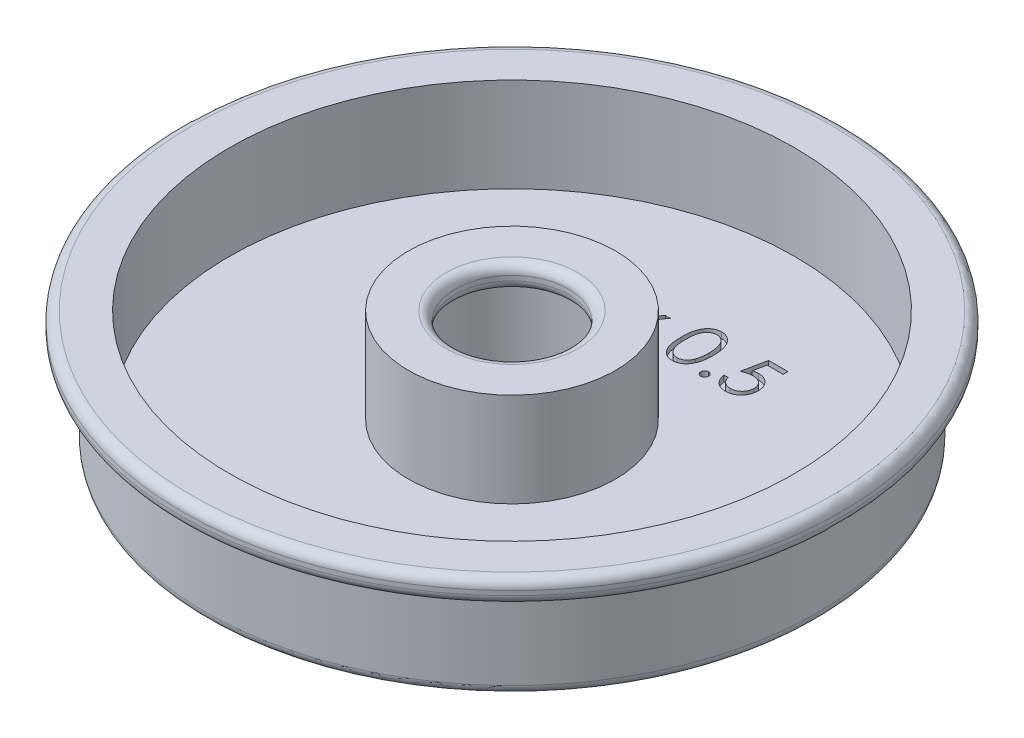
from build123d import *

# Parameters (mm, degrees)
CUT_EXTRUDE1_DEPTH = 0.79375


with BuildPart() as part:
    # Sketch1 → Revolve2 (revolve)
    with BuildSketch(Plane.XY, mode=Mode.PRIVATE) as revolve2_sk:
        with BuildLine():
            ThreePointArc((7.62, 14.641825196), (7.991974388, 15.539850808), (8.89, 15.911825196))
            Line((8.89, 15.911825196), (13.97, 15.911825196))
            Line((13.97, 15.911825196), (13.97, 3.211825196))
            Line((13.97, 3.211825196), (38.1, 3.211825196))
            Line((38.1, 3.211825196), (38.1, 15.911825196))
            Line((38.1, 15.911825196), (43.18, 15.911825196))
            ThreePointArc((43.18, 15.911825196), (44.078025612, 15.539850808), (44.45, 14.641825196))
            Line((44.45, 14.641825196), (44.45, 14.043650391))
            ThreePointArc((44.45, 14.043650391), (44.078025612, 13.145624779), (43.18, 12.773650391))
            Line((43.18, 12.773650391), (42.545, 12.773650391))
            ThreePointArc((42.545, 12.773650391), (41.646974388, 12.401676004), (41.275, 11.503650391))
            Line((41.275, 11.503650391), (41.275, 1.306825196))
            ThreePointArc((41.275, 1.306825196), (40.903025612, 0.408799584), (40.005, 0.036825196))
            Line((40.005, 0.036825196), (12.065, 0.036825196))
            ThreePointArc((12.065, 0.036825196), (11.166974388, 0.408799584), (10.795, 1.306825196))
            Line((10.795, 1.306825196), (10.795, 11.466825196))
            ThreePointArc((10.795, 11.466825196), (10.423025612, 12.364850808), (9.525, 12.736825196))
            Line((9.525, 12.736825196), (8.89, 12.736825196))
            ThreePointArc((8.89, 12.736825196), (7.991974388, 13.108799584), (7.62, 14.006825196))
            Line((7.62, 14.006825196), (7.62, 14.641825196))
        make_face()
    revolve(revolve2_sk.sketch.rotate(Axis((0, 0, 0), (0, 1, 0)), 90), axis=Axis((0, 0, 0), (0, 1, 0)))

    # Sketch2 → Cut-Extrude1 (cut)
    # profile 1 of 5: a face of its own
    with BuildSketch(Plane(origin=(0, 3.211825196, 0), x_dir=(1, 0, 0), z_dir=(0, 1, 0))):
        with BuildLine():
            Line((-11.395057384, 22.729399173), (-11.964929179, 22.729399173))
            add(Edge.make_bspline(
                [(-11.964929179, 22.729399173), (-11.949490423, 22.793320966), (-11.919308917, 22.918282841), (-11.856357605, 23.096821729), (-11.787778957, 23.265774403), (-11.705430153, 23.42197728), (-11.615607127, 23.568569575), (-11.512695904, 23.702226415), (-11.401444407, 23.826347081), (-11.278390571, 23.936498241), (-11.149342856, 24.036243549), (-11.012482903, 24.121288296), (-10.870564224, 24.194447831), (-10.72260354, 24.254718823), (-10.568160343, 24.300122273), (-10.408630884, 24.333063906), (-10.243597105, 24.354456356), (-10.131569333, 24.356544169), (-10.074684788, 24.357604302)],
                knots=[0, 0, 0, 0, 1.162005537, 2.271625781, 3.343758855, 4.383309926, 5.390229558, 6.379919256, 7.361854164, 8.333198761, 9.295911338, 10.242430842, 11.177959212, 12.116337295, 13.062827104, 14.020064771, 14.994644689, 16, 16, 16, 16], degree=3))
            add(Edge.make_bspline(
                [(-10.074684788, 24.357604302), (-9.991803242, 24.355101984), (-9.827848036, 24.350151931), (-9.586977937, 24.304950025), (-9.354700708, 24.233421571), (-9.133558787, 24.134590666), (-8.928148202, 24.012693683), (-8.745383977, 23.867614803), (-8.587743394, 23.702153214), (-8.455492166, 23.519395561), (-8.35194181, 23.324077708), (-8.275585104, 23.123054566), (-8.229100054, 22.91680299), (-8.223075615, 22.777543354), (-8.220057384, 22.707774574)],
                knots=[0, 0, 0, 0, 1.083050992, 2.142477498, 3.193116406, 4.255571735, 5.30263384, 6.308962982, 7.297363603, 8.282367274, 9.249857812, 10.179914175, 11.08814088, 12, 12, 12, 12], degree=3))
            add(Edge.make_bspline(
                [(-8.220057384, 22.707774574), (-8.222168471, 22.640633675), (-8.22629954, 22.509249355), (-8.261376406, 22.317440353), (-8.320406483, 22.136662021), (-8.402175909, 21.966153341), (-8.50802415, 21.806995417), (-8.636244614, 21.658830158), (-8.787742301, 21.5210004), (-8.902548374, 21.442043642), (-8.961653939, 21.401394366)],
                knots=[0, 0, 0, 0, 1.024540389, 2.004866551, 2.965041327, 3.920577974, 4.882998113, 5.874504559, 6.905732034, 8, 8, 8, 8], degree=3))
            add(Edge.make_bspline(
                [(-8.961653939, 21.401394366), (-8.894104898, 21.368776826), (-8.760270712, 21.304152046), (-8.577843323, 21.177413743), (-8.412239178, 21.031080084), (-8.319885287, 20.916884128), (-8.273482865, 20.859507346)],
                knots=[0, 0, 0, 0, 1.015518401, 2.012035669, 3.001164323, 4, 4, 4, 4], degree=3))
            add(Edge.make_bspline(
                [(-8.273482865, 20.859507346), (-8.242927858, 20.817673997), (-8.182318204, 20.734692349), (-8.107505164, 20.601276262), (-8.039634343, 20.466381417), (-7.986747516, 20.326392209), (-7.945792072, 20.182931169), (-7.916516699, 20.035751965), (-7.898330044, 19.88473441), (-7.895725542, 19.782567482), (-7.894416359, 19.731212074)],
                knots=[0, 0, 0, 0, 1.025084078, 2.033381695, 3.024893161, 4.013698104, 4.991890475, 5.976764909, 6.982997093, 8, 8, 8, 8], degree=3))
            add(Edge.make_bspline(
                [(-7.894416359, 19.731212074), (-7.897672119, 19.642294437), (-7.904168318, 19.464877611), (-7.962232853, 19.202759187), (-8.052245446, 18.946535776), (-8.180074459, 18.701471425), (-8.335862653, 18.472181305), (-8.521205227, 18.267028573), (-8.733996283, 18.090682534), (-8.971315103, 17.943343977), (-9.228430464, 17.825564318), (-9.503431895, 17.743817243), (-9.792356993, 17.690575215), (-9.990490233, 17.684865896), (-10.091221247, 17.681963276)],
                knots=[0, 0, 0, 0, 0.955779014, 1.907060117, 2.875433937, 3.871313158, 4.872415639, 5.851225146, 6.836215519, 7.83643374, 8.849228613, 9.86973379, 10.916971861, 12, 12, 12, 12], degree=3))
            add(Edge.make_bspline(
                [(-10.091221247, 17.681963276), (-10.159110548, 17.683538463), (-10.292694056, 17.686637905), (-10.489078689, 17.707826225), (-10.676533772, 17.746524949), (-10.855312757, 17.798600945), (-11.025574466, 17.864625963), (-11.186799342, 17.94684703), (-11.339979292, 18.043569326), (-11.483668818, 18.15593455), (-11.61785079, 18.281630695), (-11.738959304, 18.422889184), (-11.8490135, 18.57709876), (-11.945066573, 18.746050591), (-12.031493616, 18.927561272), (-12.102579066, 19.123954976), (-12.16514574, 19.333475987), (-12.194235025, 19.479485601), (-12.209159948, 19.554399173)],
                knots=[0, 0, 0, 0, 1.048658725, 2.063410685, 3.046034179, 4.001477787, 4.936774919, 5.862367409, 6.792675028, 7.730719943, 8.675894397, 9.627829632, 10.600096036, 11.597688215, 12.626045268, 13.701542398, 14.82072376, 16, 16, 16, 16], degree=3))
            Line((-12.209159948, 19.554399173), (-11.639288154, 19.554399173))
            add(Edge.make_bspline(
                [(-11.639288154, 19.554399173), (-11.624441325, 19.505505964), (-11.595562953, 19.410404424), (-11.546406155, 19.273534155), (-11.49040229, 19.148061687), (-11.43032302, 19.033066594), (-11.367224982, 18.927416378), (-11.296622189, 18.833904702), (-11.223743883, 18.748424263), (-11.168808485, 18.700264753), (-11.141922368, 18.676694846)],
                knots=[0, 0, 0, 0, 1.198163088, 2.33053128, 3.407730985, 4.417276592, 5.372219308, 6.28897303, 7.162600585, 8, 8, 8, 8], degree=3))
            add(Edge.make_bspline(
                [(-11.141922368, 18.676694846), (-11.106368579, 18.649284012), (-11.035370748, 18.594546954), (-10.919676958, 18.524694), (-10.798002093, 18.464167568), (-10.667709755, 18.417932863), (-10.531611529, 18.378784821), (-10.387507595, 18.353166165), (-10.236669301, 18.335589054), (-10.133676359, 18.334037964), (-10.081044964, 18.333245327)],
                knots=[0, 0, 0, 0, 0.946170439, 1.889420265, 2.845303464, 3.807233317, 4.801018734, 5.828864929, 6.890507805, 8, 8, 8, 8], degree=3))
            add(Edge.make_bspline(
                [(-10.081044964, 18.333245327), (-10.021620753, 18.334362755), (-9.905421836, 18.33654779), (-9.73586802, 18.356642286), (-9.574564508, 18.385907465), (-9.4233022, 18.431106734), (-9.280099708, 18.486951993), (-9.146964429, 18.557071243), (-9.022148636, 18.639339523), (-8.907251001, 18.732846283), (-8.80393558, 18.835210995), (-8.712968177, 18.942277567), (-8.635634863, 19.053594572), (-8.573253228, 19.16977802), (-8.523994373, 19.290346792), (-8.490460566, 19.41563924), (-8.467144246, 19.544629994), (-8.465245392, 19.632312552), (-8.464288154, 19.676514558)],
                knots=[0, 0, 0, 0, 1.217147791, 2.380027433, 3.494444702, 4.572153297, 5.609568379, 6.639424714, 7.649109417, 8.668170816, 9.669597737, 10.625200337, 11.543417969, 12.441394052, 13.322311151, 14.205496177, 15.095365482, 16, 16, 16, 16], degree=3))
            add(Edge.make_bspline(
                [(-8.464288154, 19.676514558), (-8.467064558, 19.735680844), (-8.472603551, 19.853719014), (-8.514891974, 20.027378041), (-8.584449627, 20.194697661), (-8.681826898, 20.352823166), (-8.800364577, 20.49937373), (-8.938912337, 20.630131991), (-9.098620694, 20.738027728), (-9.245613885, 20.81257429), (-9.375816383, 20.863441555), (-9.487241438, 20.897323276), (-9.611985561, 20.926013766), (-9.748540223, 20.95270603), (-9.897934344, 20.975423333), (-10.060005281, 20.99436777), (-10.234785877, 21.009526201), (-10.355782707, 21.016295474), (-10.418134307, 21.019783789)],
                knots=[0, 0, 0, 0, 1.07054697, 2.135767047, 3.216561865, 4.33974944, 5.486079747, 6.621378074, 7.775625952, 8.963672916, 9.598146892, 10.304877434, 11.070270905, 11.915000392, 12.823868403, 13.805723172, 14.86925407, 16, 16, 16, 16], degree=3))
            Line((-10.418134307, 21.019783789), (-10.418134307, 21.67106584))
            add(Edge.make_bspline(
                [(-10.418134307, 21.67106584), (-10.339573621, 21.672398984), (-10.185692535, 21.675010285), (-9.960912868, 21.70659339), (-9.74596843, 21.750282529), (-9.54562277, 21.817202807), (-9.363017247, 21.894927345), (-9.20459454, 21.985373497), (-9.072574145, 22.085911685), (-8.967597629, 22.198093705), (-8.888623171, 22.318408148), (-8.830880268, 22.443805513), (-8.796771104, 22.57538488), (-8.792217851, 22.665182349), (-8.789929179, 22.710318645)],
                knots=[0, 0, 0, 0, 1.321986639, 2.589447074, 3.816329219, 5.01088745, 6.139805852, 7.153945165, 8.075214402, 8.924034688, 9.728124013, 10.488707548, 11.240355623, 12, 12, 12, 12], degree=3))
            add(Edge.make_bspline(
                [(-8.789929179, 22.710318645), (-8.790681039, 22.743479696), (-8.792176829, 22.809452036), (-8.811040461, 22.90583609), (-8.839386936, 22.99927352), (-8.878357302, 23.089366976), (-8.930518376, 23.175491616), (-8.992940666, 23.258381702), (-9.067268505, 23.337563986), (-9.152440959, 23.411369709), (-9.243902377, 23.481708182), (-9.344141254, 23.541422924), (-9.450135227, 23.592486108), (-9.562001644, 23.634594776), (-9.680103534, 23.666270913), (-9.803886003, 23.689014511), (-9.933585086, 23.703234256), (-10.022070943, 23.705281525), (-10.067052577, 23.70632225)],
                knots=[0, 0, 0, 0, 0.884392785, 1.759457502, 2.611959086, 3.489218968, 4.37281399, 5.2945488, 6.255912374, 7.266815255, 8.301784654, 9.332968512, 10.37626691, 11.440494194, 12.520033166, 13.637162961, 14.798855837, 16, 16, 16, 16], degree=3))
            add(Edge.make_bspline(
                [(-10.067052577, 23.70632225), (-10.139354889, 23.703797922), (-10.28057812, 23.698867322), (-10.484168041, 23.655681855), (-10.673433118, 23.58677876), (-10.818101842, 23.504531711), (-10.924931655, 23.423341638), (-11.001271243, 23.352435023), (-11.076238455, 23.273635471), (-11.144901325, 23.182089562), (-11.214341254, 23.083996957), (-11.277559245, 22.974371135), (-11.338990401, 22.856071733), (-11.376006455, 22.772441082), (-11.395057384, 22.729399173)],
                knots=[0, 0, 0, 0, 1.472543308, 2.876219568, 4.221790263, 5.565193594, 6.249813518, 6.953379497, 7.687249741, 8.463570142, 9.283606569, 10.136032583, 11.040678096, 12, 12, 12, 12], degree=3))
        make_face()
    # profile 2 of 5: a face of its own
    with BuildSketch(Plane(origin=(0, 3.211825196, 0), x_dir=(1, 0, 0), z_dir=(0, 1, 0))):
        Polygon((-4.882236872, 22.485168404), (-4.20424208, 22.485168404), (-3.009800974, 20.811170007), (-1.815359868, 22.485168404), (-1.137365077, 22.485168404), (-2.670167561, 20.336700856), (-0.893134307, 17.844783789), (-1.571129099, 17.844783789), (-3.009800974, 19.86095967), (-4.448472849, 17.844783789), (-5.126467641, 17.844783789), (-3.348162352, 20.336700856), align=None)
    # profile 3 of 5: a face of its own
    with BuildSketch(Plane(origin=(0, 3.211825196, 0), x_dir=(1, 0, 0), z_dir=(0, 1, 0))):
        with BuildLine():
            add(Edge.make_bspline(
                [(1.793404154, 21.017239718), (1.793999273, 21.119016407), (1.795155299, 21.316719093), (1.80801572, 21.604799801), (1.829379556, 21.875056325), (1.858657361, 22.127501602), (1.894286268, 22.362200804), (1.94184865, 22.57852672), (1.995937592, 22.777480578), (2.058625601, 22.959711151), (2.12936059, 23.127673555), (2.206348463, 23.284473564), (2.29264459, 23.429873926), (2.383316989, 23.566195346), (2.482036033, 23.691206335), (2.58599241, 23.806672309), (2.699243529, 23.90992467), (2.817939558, 24.003988676), (2.943155143, 24.086447003), (3.071321123, 24.159077829), (3.203319672, 24.22112616), (3.339511176, 24.269913093), (3.478671531, 24.310209915), (3.621287209, 24.337767006), (3.767593683, 24.355105969), (3.866347858, 24.356763623), (3.916430997, 24.357604302)],
                knots=[0, 0, 0, 0, 1.646270934, 3.197905019, 4.663502075, 6.030701355, 7.308322542, 8.50163776, 9.611534131, 10.641858119, 11.616356847, 12.558055219, 13.465016945, 14.349605745, 15.204443733, 16.039544428, 16.859896111, 17.680448484, 18.487036065, 19.28249412, 20.06191084, 20.843045899, 21.620316918, 22.403196591, 23.190181807, 24, 24, 24, 24], degree=3))
            add(Edge.make_bspline(
                [(3.916430997, 24.357604302), (3.966932508, 24.356719266), (4.067364124, 24.354959207), (4.215845948, 24.338042911), (4.360897513, 24.309973874), (4.501900422, 24.270202963), (4.640012897, 24.220862235), (4.774154666, 24.159018465), (4.905158942, 24.087029663), (5.030943893, 24.002440629), (5.152890409, 23.908129928), (5.268003142, 23.801517657), (5.376292569, 23.683680309), (5.479117766, 23.555878642), (5.573561492, 23.415661417), (5.663501862, 23.265467389), (5.744005413, 23.102669963), (5.821538324, 22.9299854), (5.888461857, 22.742635619), (5.94881633, 22.541676696), (5.997582459, 22.324734957), (6.038202996, 22.092948626), (6.069671593, 21.845466478), (6.092590815, 21.58281902), (6.104697698, 21.304833454), (6.106977713, 21.114772785), (6.108147744, 21.017239718)],
                knots=[0, 0, 0, 0, 0.810914788, 1.612654377, 2.396697861, 3.181598691, 3.963628158, 4.749916497, 5.551656086, 6.361998678, 7.18212741, 8.025565596, 8.878627764, 9.750805457, 10.657531673, 11.591944965, 12.560506719, 13.57287815, 14.630710178, 15.753379473, 16.941251878, 18.199788006, 19.531962791, 20.947069417, 22.433333509, 24, 24, 24, 24], degree=3))
            add(Edge.make_bspline(
                [(6.108147744, 21.017239718), (6.106965583, 20.920132057), (6.104662192, 20.730921738), (6.092726538, 20.454186969), (6.069215879, 20.192933376), (6.039806328, 19.946534394), (5.999073867, 19.716015571), (5.948990208, 19.500579215), (5.893381765, 19.299294971), (5.824738639, 19.113811812), (5.749607779, 18.941542258), (5.66786478, 18.780674717), (5.580289524, 18.629787301), (5.484878515, 18.49008776), (5.383181608, 18.360586482), (5.273022192, 18.243569367), (5.157505559, 18.136216862), (5.035200176, 18.040691766), (4.907453504, 17.957080764), (4.776899179, 17.882307064), (4.641220755, 17.82201346), (4.503492969, 17.770242743), (4.361745791, 17.730690494), (4.21615591, 17.703342213), (4.067463882, 17.68416186), (3.966949614, 17.682698675), (3.916430997, 17.681963276)],
                knots=[0, 0, 0, 0, 1.561518951, 3.042555995, 4.452378317, 5.7783523, 7.031515105, 8.214008947, 9.334062868, 10.386615937, 11.391082383, 12.354592575, 13.286541444, 14.194233754, 15.072674879, 15.931287219, 16.775624067, 17.606195743, 18.42308326, 19.229000347, 20.022332153, 20.807536673, 21.593273796, 22.3848459, 23.188221202, 24, 24, 24, 24], degree=3))
            add(Edge.make_bspline(
                [(3.916430997, 17.681963276), (3.866349247, 17.682809378), (3.767597812, 17.684477726), (3.621271269, 17.701738353), (3.47924455, 17.729488766), (3.340816811, 17.768344605), (3.205277848, 17.815905808), (3.074474585, 17.877870348), (2.946952644, 17.949233588), (2.82305225, 18.030505281), (2.705101615, 18.123617477), (2.592437002, 18.226604115), (2.487888754, 18.342035162), (2.39058118, 18.468087965), (2.29809962, 18.603602848), (2.2130289, 18.750430039), (2.134341779, 18.907987346), (2.06241716, 19.077292698), (1.998647442, 19.260816639), (1.942318029, 19.46065872), (1.897842343, 19.678582803), (1.859773267, 19.912838597), (1.829067601, 20.164432728), (1.808104753, 20.433501783), (1.795148367, 20.71987809), (1.793996168, 20.916310395), (1.793404154, 21.017239718)],
                knots=[0, 0, 0, 0, 0.810891512, 1.598919785, 2.382837074, 3.152667961, 3.926044502, 4.706494248, 5.493654104, 6.291793342, 7.103789334, 7.925228297, 8.761435821, 9.622817696, 10.50288917, 11.416980706, 12.369136599, 13.353924996, 14.394355917, 15.514179734, 16.714354668, 17.994756427, 19.357759367, 20.818452758, 22.365282078, 24, 24, 24, 24], degree=3))
        make_face()
        with BuildLine():
            add(Edge.make_bspline(
                [(2.363275949, 21.019783789), (2.36349266, 20.934968292), (2.363913254, 20.770358068), (2.374900932, 20.531156723), (2.38986921, 20.308053412), (2.409175564, 20.100764853), (2.437846627, 19.909992688), (2.469971799, 19.734424834), (2.509066191, 19.574990418), (2.555321437, 19.43059539), (2.608006656, 19.298789223), (2.665530151, 19.176141304), (2.727326034, 19.061202791), (2.796485065, 18.955006102), (2.871805251, 18.857204918), (2.951585307, 18.766068208), (3.03880271, 18.684793685), (3.1594595, 18.587317819), (3.318747389, 18.486590248), (3.519444501, 18.398876628), (3.725671547, 18.343754171), (3.865645958, 18.336744214), (3.935511526, 18.333245327)],
                knots=[0, 0, 0, 0, 1.459021318, 2.831673884, 4.118529203, 5.306027144, 6.411944654, 7.436330062, 8.375795394, 9.233974572, 10.042671642, 10.816086306, 11.563610507, 12.285937304, 12.993564865, 13.685989202, 14.367179055, 15.041617293, 16.353048772, 17.594441528, 18.799311195, 20, 20, 20, 20], degree=3))
            add(Edge.make_bspline(
                [(3.935511526, 18.333245327), (4.005829016, 18.336144158), (4.146318817, 18.341935835), (4.351575845, 18.397813544), (4.550839335, 18.482122566), (4.706998427, 18.58181304), (4.82580247, 18.67675158), (4.910923295, 18.7576953), (4.989050154, 18.848329516), (5.063149347, 18.946118239), (5.131110813, 19.052929746), (5.192911077, 19.168250418), (5.24930515, 19.292400498), (5.281434419, 19.379068453), (5.297861286, 19.423379542)],
                knots=[0, 0, 0, 0, 1.353760809, 2.704726607, 4.075137775, 5.516104923, 6.260822281, 7.007110065, 7.778089737, 8.566572457, 9.372053459, 10.217411131, 11.088608312, 12, 12, 12, 12], degree=3))
            add(Edge.make_bspline(
                [(5.297861286, 19.423379542), (5.317005207, 19.480039212), (5.355875578, 19.595082642), (5.405971226, 19.77354241), (5.445423593, 19.960781711), (5.480917128, 20.155681565), (5.505143386, 20.359679309), (5.52464299, 20.572143748), (5.536128665, 20.793235077), (5.537552428, 20.943448846), (5.538275949, 21.019783789)],
                knots=[0, 0, 0, 0, 0.884706709, 1.796334032, 2.740027952, 3.714592787, 4.726048262, 5.777819803, 6.87074269, 8, 8, 8, 8], degree=3))
            add(Edge.make_bspline(
                [(5.538275949, 21.019783789), (5.537277749, 21.096106385), (5.535325055, 21.245409698), (5.527861106, 21.464064111), (5.508586906, 21.671741335), (5.487179934, 21.869336049), (5.455616404, 22.055754456), (5.421584383, 22.232557152), (5.375862183, 22.397553783), (5.32702202, 22.553327596), (5.27112316, 22.698108783), (5.209590328, 22.832572367), (5.143873708, 22.95736751), (5.072495643, 23.072151819), (4.996303476, 23.177439432), (4.913286208, 23.27111934), (4.826736846, 23.356094982), (4.70551138, 23.453091357), (4.546808026, 23.551991148), (4.349330923, 23.643006169), (4.143825611, 23.695272643), (4.004899487, 23.702641704), (3.935511526, 23.70632225)],
                knots=[0, 0, 0, 0, 1.31362396, 2.569729283, 3.763502607, 4.902122613, 5.988968491, 7.01645872, 7.998833611, 8.933434873, 9.825090667, 10.667526885, 11.477055099, 12.250526234, 12.991942729, 13.710640831, 14.402115721, 15.076753259, 16.378508321, 17.609869233, 18.806226677, 20, 20, 20, 20], degree=3))
            add(Edge.make_bspline(
                [(3.935511526, 23.70632225), (3.865279452, 23.702636626), (3.724687357, 23.695258662), (3.517046068, 23.643200902), (3.31801103, 23.552463092), (3.159727347, 23.452763788), (3.038417335, 23.357807137), (2.952995877, 23.275463142), (2.872902107, 23.185390652), (2.79911928, 23.086690035), (2.730014437, 22.980617154), (2.666548886, 22.866337538), (2.609367445, 22.743272063), (2.556599786, 22.611525102), (2.510203442, 22.467142531), (2.471932966, 22.3079045), (2.436577884, 22.132895068), (2.411549325, 21.941089675), (2.389299368, 21.733749197), (2.375000351, 21.510088919), (2.363876498, 21.2704864), (2.363480141, 21.10502507), (2.363275949, 21.019783789)],
                knots=[0, 0, 0, 0, 1.207732386, 2.417664972, 3.655092373, 4.956220595, 5.625982001, 6.301752483, 6.994047911, 7.697131622, 8.419323945, 9.170223765, 9.943494443, 10.752040957, 11.610060368, 12.549350801, 13.567764191, 14.679664412, 15.874934091, 17.154273443, 18.533957287, 20, 20, 20, 20], degree=3))
        make_face(mode=Mode.SUBTRACT)
    # profile 4 of 5: a face of its own
    with BuildSketch(Plane(origin=(0, 3.211825196, 0), x_dir=(1, 0, 0), z_dir=(0, 1, 0))):
        with BuildLine():
            add(Edge.make_bspline(
                [(7.695647744, 18.821706866), (7.731008557, 18.81960562), (7.800329298, 18.815486375), (7.90054886, 18.787225838), (7.991253457, 18.737045125), (8.072047672, 18.670165513), (8.138643708, 18.58907481), (8.190612747, 18.499093661), (8.218627106, 18.398035058), (8.222716346, 18.328312648), (8.224814411, 18.292540199)],
                knots=[0, 0, 0, 0, 1.020151414, 1.999887582, 2.974338812, 3.990962822, 5.007586832, 5.987933904, 6.967670073, 8, 8, 8, 8], degree=3))
            add(Edge.make_bspline(
                [(8.224814411, 18.292540199), (8.222645249, 18.257627301), (8.218367695, 18.188779578), (8.190676963, 18.08848321), (8.138247643, 17.998445826), (8.072507013, 17.916254804), (7.991233484, 17.84923351), (7.90033442, 17.799479728), (7.800564565, 17.769195707), (7.731047807, 17.765337997), (7.695647744, 17.763373532)],
                knots=[0, 0, 0, 0, 1.009421747, 1.99056486, 2.972319754, 3.999869655, 5.017953583, 5.993804169, 6.978383603, 8, 8, 8, 8], degree=3))
            add(Edge.make_bspline(
                [(7.695647744, 17.763373532), (7.660222172, 17.765266916), (7.591062177, 17.768963296), (7.49166473, 17.800101531), (7.400212087, 17.848766951), (7.318954381, 17.916379773), (7.252663154, 17.99802289), (7.202542817, 18.089103292), (7.172443547, 18.188492471), (7.168485006, 18.257570752), (7.166481077, 18.292540199)],
                knots=[0, 0, 0, 0, 1.022052826, 1.995314843, 2.982371812, 4.00089066, 5.028879526, 6.005146991, 6.990147033, 8, 8, 8, 8], degree=3))
            add(Edge.make_bspline(
                [(7.166481077, 18.292540199), (7.168408029, 18.328371216), (7.172170165, 18.39832688), (7.202606006, 18.498473833), (7.252274276, 18.589493715), (7.319412635, 18.670041796), (7.400192429, 18.737510188), (7.491444116, 18.786613456), (7.591301568, 18.815715346), (7.660262456, 18.819675055), (7.695647744, 18.821706866)],
                knots=[0, 0, 0, 0, 1.032775665, 2.016367738, 2.991239715, 4.008302682, 5.025365648, 6.011011707, 6.979408107, 8, 8, 8, 8], degree=3))
        make_face()
    # profile 5 of 5: a face of its own
    with BuildSketch(Plane(origin=(0, 3.211825196, 0), x_dir=(1, 0, 0), z_dir=(0, 1, 0))):
        with BuildLine():
            Line((13.028019539, 24.194783789), (13.028019539, 23.543501738))
            Line((13.028019539, 23.543501738), (10.868103673, 23.543501738))
            Line((10.868103673, 23.543501738), (10.525926189, 21.873319446))
            add(Edge.make_bspline(
                [(10.525926189, 21.873319446), (10.593156133, 21.891880082), (10.723403515, 21.927838379), (10.915644977, 21.967763133), (11.098147975, 21.991830439), (11.216576147, 21.995116674), (11.27388292, 21.996706866)],
                knots=[0, 0, 0, 0, 1.100273476, 2.13160584, 3.095893838, 4, 4, 4, 4], degree=3))
            add(Edge.make_bspline(
                [(11.27388292, 21.996706866), (11.344791991, 21.995172097), (11.48421694, 21.992154357), (11.688213315, 21.963176859), (11.88294585, 21.917565871), (12.068007293, 21.85384721), (12.243740007, 21.772368123), (12.408527154, 21.670586802), (12.564842225, 21.551690616), (12.709880931, 21.414993237), (12.841460747, 21.264549732), (12.957150471, 21.102791881), (13.055416885, 20.931291694), (13.13444854, 20.748410589), (13.197557261, 20.556170411), (13.239561594, 20.35254844), (13.267531909, 20.139463993), (13.27065681, 19.993768559), (13.272250308, 19.919473292)],
                knots=[0, 0, 0, 0, 1.052922333, 2.070308379, 3.05430497, 4.020497103, 4.973039431, 5.925935799, 6.892292201, 7.88610001, 8.88166317, 9.857072816, 10.836096531, 11.812156883, 12.81219415, 13.836441305, 14.89672472, 16, 16, 16, 16], degree=3))
            add(Edge.make_bspline(
                [(13.272250308, 19.919473292), (13.271043671, 19.867725835), (13.268646705, 19.764930243), (13.256457267, 19.612268622), (13.232988182, 19.462838911), (13.201478169, 19.316621285), (13.160579782, 19.173892567), (13.111069641, 19.034244224), (13.050479706, 18.898545437), (12.984019925, 18.765512221), (12.909187029, 18.638152072), (12.826131737, 18.519046053), (12.738382917, 18.406407428), (12.643964975, 18.301444227), (12.542000312, 18.20484618), (12.433723801, 18.116040012), (12.319999439, 18.033523885), (12.199067786, 17.960647302), (12.073623566, 17.893585939), (11.94185523, 17.838570378), (11.806762245, 17.789384134), (11.666400256, 17.750178277), (11.521087196, 17.719457785), (11.370583532, 17.69859241), (11.215678602, 17.683395159), (11.110676793, 17.682443826), (11.057636927, 17.681963276)],
                knots=[0, 0, 0, 0, 1.056347294, 2.098418968, 3.122841568, 4.141288669, 5.149314143, 6.15115421, 7.162517403, 8.180376062, 9.185164535, 10.17417709, 11.141909838, 12.097768115, 13.052685741, 14.0056014, 14.954263652, 15.917497458, 16.885230207, 17.854509472, 18.828990115, 19.81800267, 20.826176721, 21.857883937, 22.917946725, 24, 24, 24, 24], degree=3))
            add(Edge.make_bspline(
                [(11.057636927, 17.681963276), (10.994365199, 17.683216653), (10.869885549, 17.685682526), (10.68751252, 17.71147892), (10.512044592, 17.748424883), (10.344894266, 17.80400783), (10.184563545, 17.87365335), (10.0332109, 17.961675547), (9.886968992, 18.061423349), (9.751782868, 18.179134847), (9.626313919, 18.307796156), (9.513997824, 18.447419305), (9.413969764, 18.595699864), (9.327831566, 18.753357943), (9.254356584, 18.919979278), (9.196635105, 19.096188151), (9.150047233, 19.281063873), (9.130337884, 19.408342384), (9.120327231, 19.472988917)],
                knots=[0, 0, 0, 0, 1.0467383, 2.05933395, 3.04377827, 4.011590433, 4.970194871, 5.932262533, 6.905835911, 7.896367577, 8.894135286, 9.877477877, 10.858688626, 11.851381753, 12.8477658, 13.868841284, 14.917554742, 16, 16, 16, 16], degree=3))
            Line((9.120327231, 19.472988917), (9.690199026, 19.472988917))
            add(Edge.make_bspline(
                [(9.690199026, 19.472988917), (9.704220837, 19.412434496), (9.731171537, 19.296045537), (9.790327681, 19.132521532), (9.86265577, 18.986799512), (9.948660802, 18.856951839), (10.051258714, 18.743724087), (10.168333535, 18.642818846), (10.299592976, 18.551786826), (10.445449264, 18.475908377), (10.599324422, 18.411195067), (10.760373503, 18.368102706), (10.924211389, 18.337802515), (11.035025003, 18.334769463), (11.090709843, 18.333245327)],
                knots=[0, 0, 0, 0, 1.136247022, 2.183929868, 3.172523383, 4.106158343, 5.02341133, 5.958108904, 6.928429099, 7.938127109, 8.96079061, 9.975095812, 10.982467395, 12, 12, 12, 12], degree=3))
            add(Edge.make_bspline(
                [(11.090709843, 18.333245327), (11.145063021, 18.334734453), (11.252084873, 18.337666553), (11.409585531, 18.360234475), (11.561646032, 18.394991783), (11.70676595, 18.447007092), (11.847484744, 18.510225366), (11.98024287, 18.59135129), (12.108880947, 18.684714466), (12.229400561, 18.791678638), (12.339780704, 18.909552227), (12.437309667, 19.035604069), (12.518547781, 19.170073205), (12.587008236, 19.310631639), (12.638993507, 19.458819879), (12.676079287, 19.613943439), (12.697856265, 19.776385475), (12.700851977, 19.887182651), (12.702378513, 19.943641962)],
                knots=[0, 0, 0, 0, 1.027316725, 2.022795036, 3.002884548, 3.971462791, 4.93288096, 5.914575861, 6.907176829, 7.935150275, 8.956128384, 9.956726525, 10.942570165, 11.921478529, 12.907843606, 13.90538589, 14.932640048, 16, 16, 16, 16], degree=3))
            add(Edge.make_bspline(
                [(12.702378513, 19.943641962), (12.701183843, 19.994579397), (12.698845447, 20.094282179), (12.679739984, 20.24014931), (12.646507762, 20.378167544), (12.60038158, 20.509003369), (12.54181733, 20.632780185), (12.47025045, 20.749625737), (12.384337856, 20.857999978), (12.286199715, 20.957953611), (12.178688698, 21.050200741), (12.059955051, 21.128839298), (11.932483469, 21.194995263), (11.797809768, 21.252087202), (11.652730594, 21.293091412), (11.50011899, 21.323876004), (11.338326963, 21.341683876), (11.227708714, 21.344154731), (11.170848064, 21.345424814)],
                knots=[0, 0, 0, 0, 1.045622112, 2.046656509, 3.013763289, 3.955457236, 4.890082067, 5.820317437, 6.762574623, 7.722996705, 8.69280354, 9.665887285, 10.63943826, 11.638615906, 12.663482002, 13.728887084, 14.832589034, 16, 16, 16, 16], degree=3))
            add(Edge.make_bspline(
                [(11.170848064, 21.345424814), (11.121628436, 21.344371456), (11.020002392, 21.342196539), (10.864113835, 21.326182752), (10.700298852, 21.300348603), (10.52918541, 21.264813554), (10.350259631, 21.218311458), (10.163899104, 21.162586578), (9.969711991, 21.09596238), (9.838869834, 21.045648221), (9.771609282, 21.019783789)],
                knots=[0, 0, 0, 0, 0.817624296, 1.688186739, 2.600797293, 3.572016777, 4.590301741, 5.671205678, 6.80286297, 8, 8, 8, 8], degree=3))
            Line((9.771609282, 21.019783789), (10.422891334, 24.194783789))
            Line((10.422891334, 24.194783789), (13.028019539, 24.194783789))
        make_face()
    extrude(amount=-CUT_EXTRUDE1_DEPTH, mode=Mode.SUBTRACT)


solid = part.part
